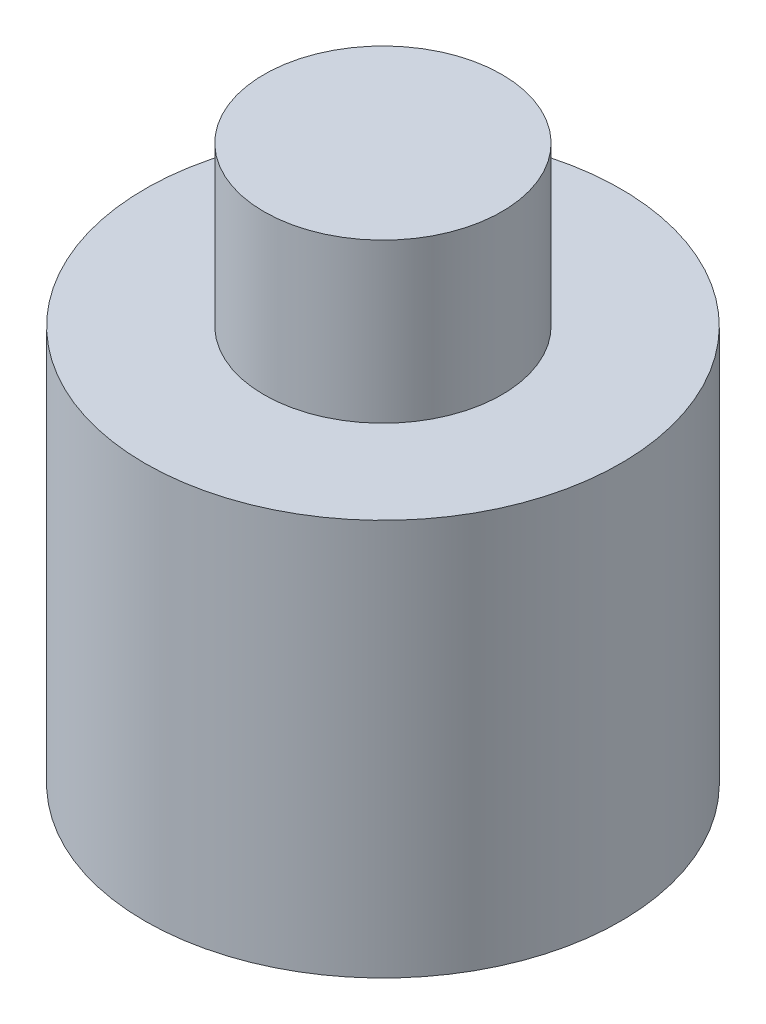
from build123d import *

# Parameters (mm, degrees)
SKETCH1_R           = 30
BOSS_EXTRUDE1_DEPTH = 50
SKETCH3_R           = 15
BOSS_EXTRUDE3_DEPTH = 20


with BuildPart() as part:
    # Sketch1 → Boss-Extrude1 (new body)
    with BuildSketch(Plane(origin=(0, 0, 0), x_dir=(1, 0, 0), z_dir=(0, 1, 0))):
        with Locations(Location((0, 0, 0), (0, 0, 270))):
            Circle(SKETCH1_R)
    extrude(amount=BOSS_EXTRUDE1_DEPTH)

    # Sketch3 → Boss-Extrude3 (add)
    with BuildSketch(Plane(origin=(0, 50, 0), x_dir=(1, 0, 0), z_dir=(0, 1, 0))):
        with Locations(Location((0, 0, 0), (0, 0, 270))):
            Circle(SKETCH3_R)
    extrude(amount=BOSS_EXTRUDE3_DEPTH)


solid = part.part
